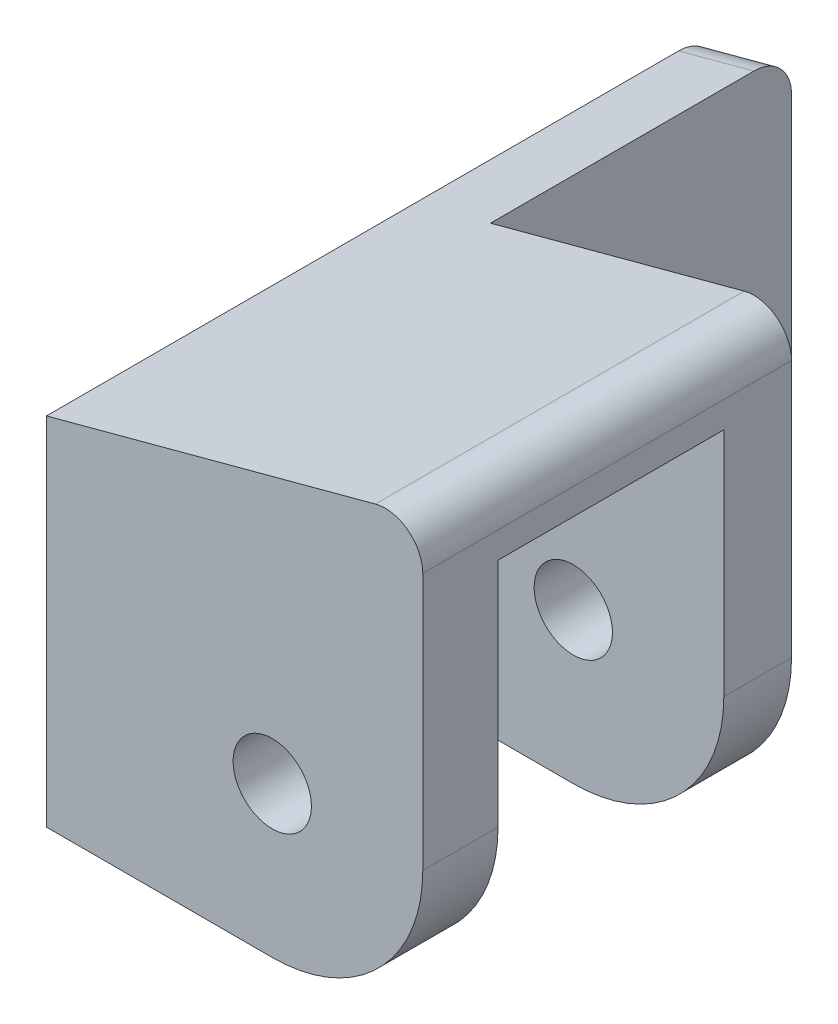
from build123d import *

# Parameters (mm, degrees)
EXTRUDE_1_DEPTH     = 4.5
EXTRUDE_5_DEPTH     = 19.5
EXTRUDE_6_DEPTH     = 20
EXTRUDE_7_DEPTH     = 5
SKETCH_6_R          = 2.6
CUT_EXTRUDE_1_DEPTH = 36.209916548
SKETCH_13_R         = 2.6
CUT_EXTRUDE_2_DEPTH = 41.493681277
FILLET_1_R          = 2.5
FILLET_2_R          = 10


with BuildPart() as part:
    # Эскиз1 → Бобышка-Вытянуть1 (new body)
    with BuildSketch(Plane.XY):
        Polygon((10, 10), (-10, 10), (-10, -10), (10, -15.358983849), align=None)
    extrude(amount=EXTRUDE_1_DEPTH)

    # Эскиз10 → Бобышка-Вытянуть5 (add)
    with BuildSketch(Plane(origin=(0, 0, 0), x_dir=(-1, 0, 0), z_dir=(0, 0, -1))):
        Polygon((15, 10), (15, -13.660254038), (-10, -20.358983849), (-10, -15.358983849), (10, -10), (10, 10), align=None)
    extrude(amount=-EXTRUDE_5_DEPTH)

    # Эскиз11 → Бобышка-Вытянуть6 (add)
    with BuildSketch(Plane(origin=(0, 0, 0), x_dir=(-1, 0, 0), z_dir=(0, 0, -1))):
        Polygon((15, 10), (10, 10), (10, -15), (15, -13.660254038), align=None)
    extrude(amount=EXTRUDE_6_DEPTH)

    # Эскиз12 → Бобышка-Вытянуть7 (add)
    with BuildSketch(Plane.XY.offset(19.5)):
        Polygon((-15, -13.660254038), (10, -20.358983849), (10, 10), (-15, 10), align=None)
    extrude(amount=EXTRUDE_7_DEPTH)

    # Эскиз6 → Вырез-Вытянуть1 (cut, through all)
    with BuildSketch(Plane(origin=(0, 0, 0), x_dir=(-1, 0, 0), z_dir=(0, 0, -1))):
        Circle(SKETCH_6_R)
    extrude(amount=-CUT_EXTRUDE_1_DEPTH, mode=Mode.SUBTRACT)

    # Эскиз13 → Вырез-Вытянуть2 (cut, through all)
    with BuildSketch(Plane.ZY.offset(15)):
        with Locations(Location((-10, -1.830127019, 0), (0, 0, 270))):
            Circle(SKETCH_13_R)
    extrude(amount=-CUT_EXTRUDE_2_DEPTH, mode=Mode.SUBTRACT)

    # Скругление1
    fillet_1_edges = [part.edges().sort_by_distance(p)[0] for p in [
        (10, -20.358983849, 12.25),
        (-12.5, 10, -20),
        (-12.5, -14.330127019, -20),
    ]]
    fillet(fillet_1_edges, radius=FILLET_1_R)

    # Скругление2
    fillet_2_edges = [part.edges().sort_by_distance(p)[0] for p in [
        (10, 10, 22),
        (10, 10, 2.25),
    ]]
    fillet(fillet_2_edges, radius=FILLET_2_R)


with BuildPart() as body_2:
    # Зеркальное отражение1: mirrored copy
    add(part.part.mirror(Plane.ZX))


solid = body_2.part
